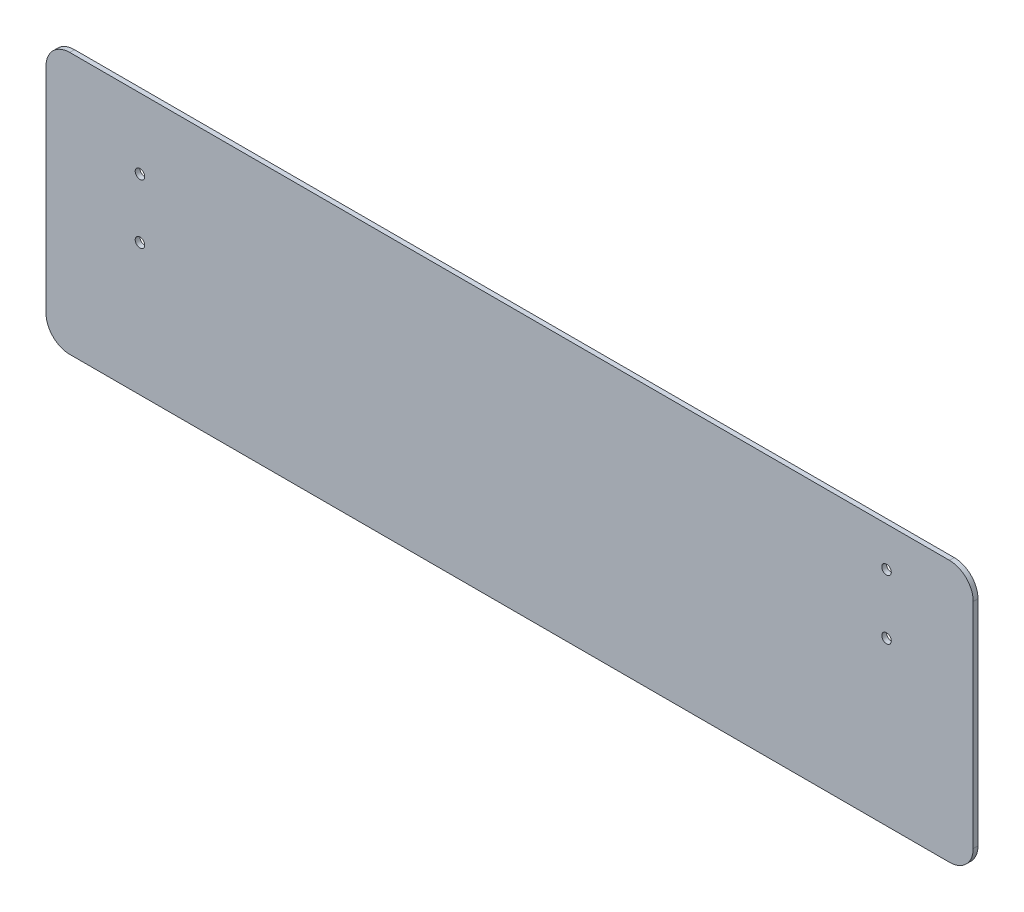
from build123d import *

# Parameters (mm, degrees)
BOSS_EXTRU_1_DEPTH      = 2
ESQUISSE6_R             = 2
ENL_V_MAT_EXTRU_1_DEPTH = 10


with BuildPart() as part:
    # Esquisse1 → Boss.-Extru.1 (new body)
    with BuildSketch(Plane.XY):
        with BuildLine():
            Line((-185, 55), (185, 55))
            ThreePointArc((185, 55), (192.071067812, 52.071067812), (195, 45))
            Line((195, 45), (195, -45))
            ThreePointArc((195, -45), (192.071067812, -52.071067812), (185, -55))
            Line((185, -55), (-185, -55))
            ThreePointArc((-185, -55), (-192.071067812, -52.071067812), (-195, -45))
            Line((-195, -45), (-195, 45))
            ThreePointArc((-195, 45), (-192.071067812, 52.071067812), (-185, 55))
        make_face()
    extrude(amount=BOSS_EXTRU_1_DEPTH)

    # Esquisse6 → Enlèv. mat.-Extru.1 (cut)
    with BuildSketch(Plane.XY.offset(2)):
        with Locations((158.522603101, 13.37629565)):
            Circle(ESQUISSE6_R)
        with Locations((158.522603101, 38.37629565)):
            Circle(ESQUISSE6_R)
        with Locations((-155.477396899, 25.510661874)):
            Circle(ESQUISSE6_R)
        with Locations((-155.477396899, 0.510661874)):
            Circle(ESQUISSE6_R)
    extrude(amount=-ENL_V_MAT_EXTRU_1_DEPTH, mode=Mode.SUBTRACT)


solid = part.part
